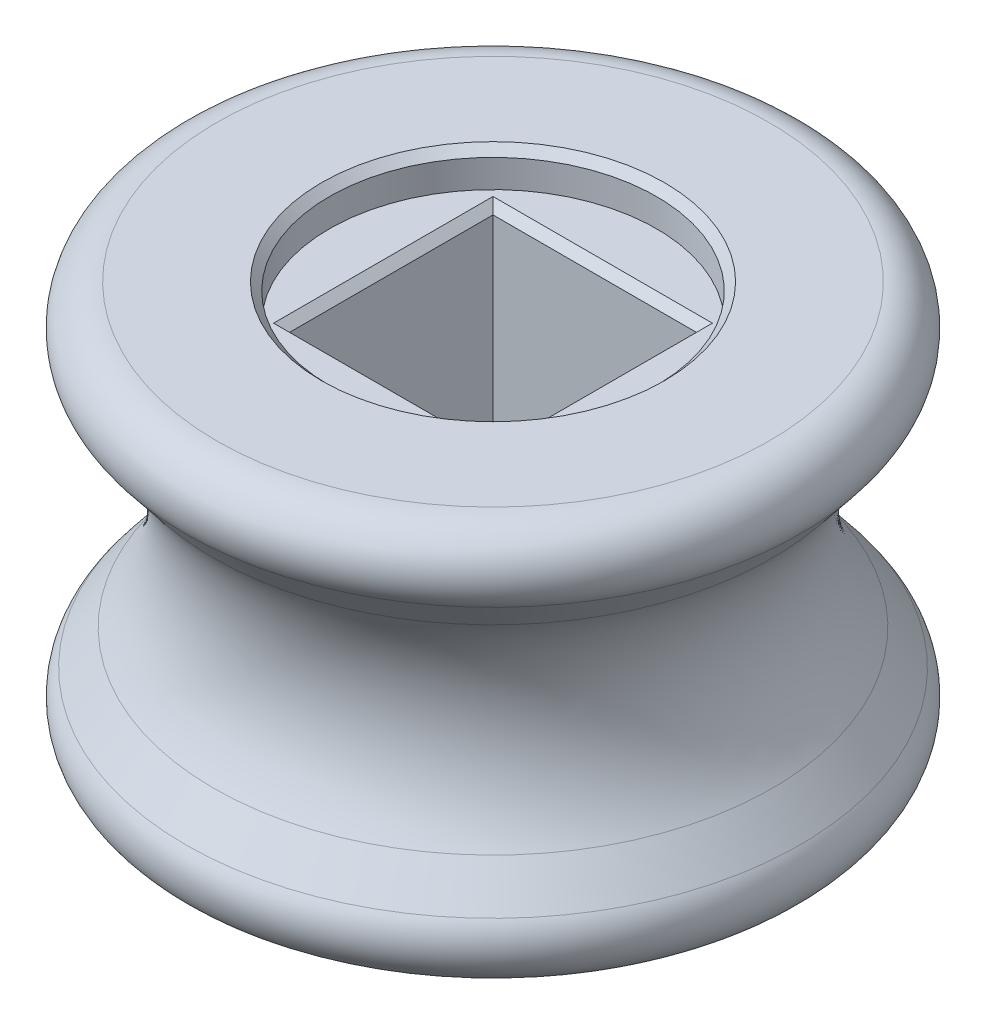
from build123d import *

# Parameters (mm, degrees)
FILLET1_R                       = 5.08
FILLET2_R                       = 1.27
BOSS_EXTRUDE1_REACH             = 19.048
SKETCH2_R                       = 4.7625
SKETCH2_W                       = 6.477
SKETCH2_H                       = 6.477
BOSS_EXTRUDE1_DIRECTION_2_REACH = 19.048
SKETCH3_W                       = 6.477
SKETCH3_H                       = 6.477
CUT_EXTRUDE1_DEPTH              = 18.047970635
SKETCH4_R                       = 5.207
CUT_EXTRUDE2_DEPTH              = 1.143
CHAMFER2_SIZE                   = 0.254


with BuildPart() as part:
    # Sketch1 → Revolve1 (revolve)
    with BuildSketch(Plane.XY, mode=Mode.PRIVATE) as revolve1_sk:
        Polygon((4.7625, 0), (4.7625, 3.302), (2.8575, 3.302), (2.8575, 9.398), (4.7625, 9.398), (4.7625, 12.7), (11.43, 12.7), (6.35, 6.35), (11.43, 0), align=None)
    revolve(revolve1_sk.sketch.rotate(Axis((0, 0, 0), (0, 1, 0)), 90), axis=Axis((0, 0, 0), (0, 1, 0)))

    # Fillet1
    fillet1_edges = [part.edges().sort_by_distance(p)[0] for p in [
        (0, 6.35, 6.35),
    ]]
    fillet(fillet1_edges, radius=FILLET1_R)

    # Fillet2
    fillet2_edges = [part.edges().sort_by_distance(p)[0] for p in [
        (0, 0, 11.43),
        (0, 12.7, 11.43),
    ]]
    fillet(fillet2_edges, radius=FILLET2_R)

    # Boss-Extrude1: up to this face of the body (flat: up to its plane)
    boss_extrude1_end = Plane(part.part.faces().sort_by_distance((0, 12.7, 8.539055399))[0])
    # Sketch2 → Boss-Extrude1 (add, up to the picked face)
    with BuildSketch(Plane(origin=(0, 9.398, 0), x_dir=(1, 0, 0), z_dir=(0, 1, 0)), mode=Mode.PRIVATE) as boss_extrude1_sk1:
        Circle(SKETCH2_R)
        Rectangle(SKETCH2_W, SKETCH2_H, mode=Mode.SUBTRACT)
    boss_extrude1_tool1 = split(extrude(boss_extrude1_sk1.sketch, amount=BOSS_EXTRUDE1_REACH, mode=Mode.PRIVATE), bisect_by=boss_extrude1_end, keep=Keep.BOTH, mode=Mode.PRIVATE)
    add(boss_extrude1_tool1.solids().sort_by(Axis((-4.627796, 9.398, 0), (0, 1, 0)))[0])

    # Boss-Extrude1 direction 2: up to this face of the body (flat: up to its plane)
    boss_extrude1_direction_2_end = Plane(part.part.faces().sort_by_distance((0, 0, 8.539055399))[0])
    # Sketch2 → Boss-Extrude1 direction 2 (add, up to the picked face)
    with BuildSketch(Plane(origin=(0, 9.398, 0), x_dir=(1, 0, 0), z_dir=(0, 1, 0)), mode=Mode.PRIVATE) as boss_extrude1_direction_2_sk1:
        Circle(SKETCH2_R)
        Rectangle(SKETCH2_W, SKETCH2_H, mode=Mode.SUBTRACT)
    boss_extrude1_direction_2_tool1 = split(extrude(boss_extrude1_direction_2_sk1.sketch, amount=-BOSS_EXTRUDE1_DIRECTION_2_REACH, mode=Mode.PRIVATE), bisect_by=boss_extrude1_direction_2_end, keep=Keep.BOTH, mode=Mode.PRIVATE)
    add(boss_extrude1_direction_2_tool1.solids().sort_by(Axis((-4.627796, 9.398, 0), (0, -1, 0)))[0])

    # Sketch3 → Cut-Extrude1 (cut, through all)
    with BuildSketch(Plane(origin=(0, 9.398, 0), x_dir=(1, 0, 0), z_dir=(0, 1, 0))):
        Rectangle(SKETCH3_W, SKETCH3_H)
    extrude(amount=-CUT_EXTRUDE1_DEPTH, mode=Mode.SUBTRACT)

    # Sketch4 → Cut-Extrude2 (cut)
    with BuildSketch(Plane(origin=(0, 12.7, 0), x_dir=(1, 0, 0), z_dir=(0, 1, 0))):
        with Locations(Location((0, 0, 0), (0, 0, 270))):
            Circle(SKETCH4_R)
    cut_extrude2 = extrude(amount=-CUT_EXTRUDE2_DEPTH, mode=Mode.SUBTRACT)

    # Mirror1: Cut-Extrude2 across plane
    add(cut_extrude2.mirror(Plane.ZX.offset(6.35)), mode=Mode.SUBTRACT)

    # Chamfer2
    chamfer2_edges = [part.edges().sort_by_distance(p)[0] for p in [
        (3.2385, 11.557, 0),
        (-3.2385, 11.557, 0),
        (0, 11.557, 3.2385),
        (0, 11.557, -3.2385),
        (0, 12.7, -5.207),
        (3.2385, 1.143, 0),
        (0, 0, -5.207),
        (0, 1.143, 3.2385),
        (-3.2385, 1.143, 0),
        (0, 1.143, -3.2385),
    ]]
    chamfer(chamfer2_edges, length=CHAMFER2_SIZE)


solid = part.part
